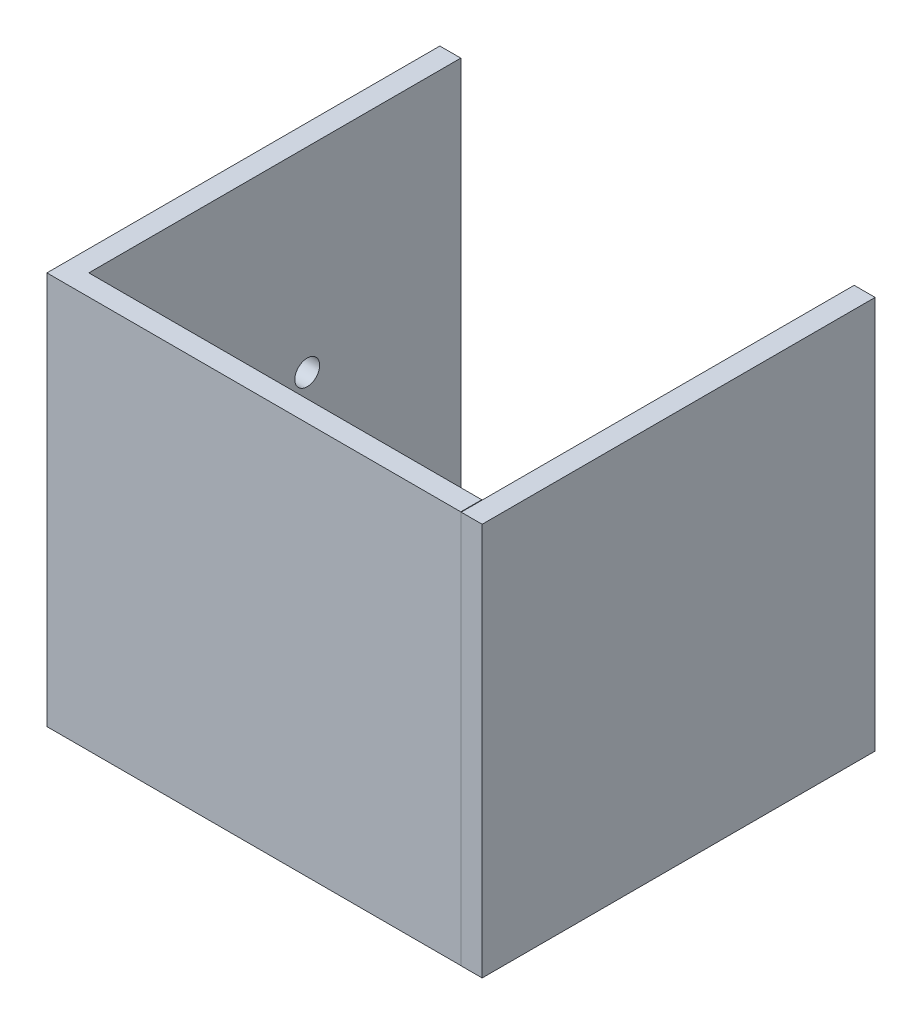
from build123d import *

# Parameters (mm, degrees)
SKETCH1_W           = 150
SKETCH1_H           = 150
BOSS_EXTRUDE1_DEPTH = 8
SKETCH3_W           = 150
SKETCH3_H           = 150
BOSS_EXTRUDE2_DEPTH = 8
SKETCH4_W           = 150
SKETCH4_H           = 150
SKETCH4_R           = 4.743192734
BOSS_EXTRUDE3_DEPTH = 8


with BuildPart() as part:
    # Sketch1 → Boss-Extrude1 (new body)
    with BuildSketch(Plane.XY):
        Rectangle(SKETCH1_W, SKETCH1_H)
    extrude(amount=BOSS_EXTRUDE1_DEPTH)

    # Sketch3 → Boss-Extrude2 (add)
    with BuildSketch(Plane(origin=(75, 0, 0), x_dir=(0, 0, -1), z_dir=(1, 0, 0))):
        with Locations((67.149717674, -0.182693133)):
            Rectangle(SKETCH3_W, SKETCH3_H)
    extrude(amount=BOSS_EXTRUDE2_DEPTH)

    # Sketch4 → Boss-Extrude3 (add)
    with BuildSketch(Plane.ZY.offset(75)):
        with Locations((-67, 0)):
            Rectangle(SKETCH4_W, SKETCH4_H)
        with Locations(Location((-83.382184019, 0.420229312, 0), (0, 0, 270))):
            Circle(SKETCH4_R, mode=Mode.SUBTRACT)
    extrude(amount=BOSS_EXTRUDE3_DEPTH)


solid = part.part
